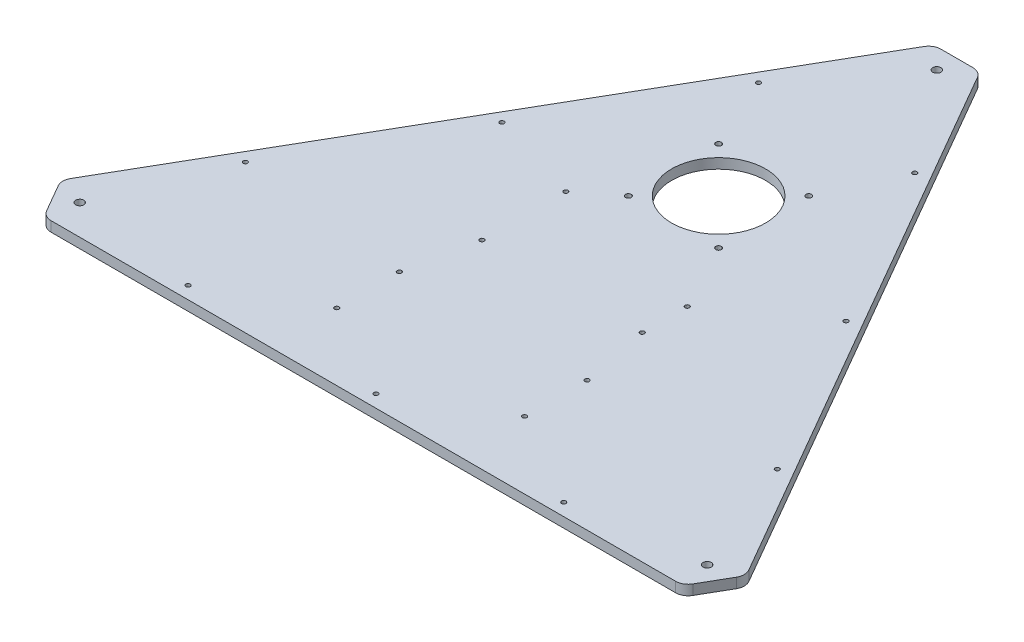
from build123d import *

# Parameters (mm, degrees)
SKETCH_1_R         = 3.25
SKETCH_1_R_2       = 37.5
SKETCH_1_R_3       = 2.25
SKETCH_1_R_4       = 1.75
EXTRUDE_1639_DEPTH = 4
FILLET_1_R         = 10
HOLE_WIZARD_3_5_D  = 3.5


with BuildPart() as part:
    # Эскиз1 → Extrude 1639 (new, symmetric)
    with BuildSketch(Plane(origin=(0, 0, 0), x_dir=(1, 0, 0), z_dir=(0, 1, 0))):
        Polygon((273.664027596, -136.63804004), (18.5, 305.31902002), (-18.5, 305.31902002), (-273.664027596, -136.63804004), (-255.164027596, -168.68097998), (255.164027596, -168.68097998), align=None)
        with Locations(Location((-250.557621135, -144.65951001, 0), (0, 0, 270))):
            Circle(SKETCH_1_R, mode=Mode.SUBTRACT)
        with Locations(Location((250.557621135, -144.65951001, 0), (0, 0, 270))):
            Circle(SKETCH_1_R, mode=Mode.SUBTRACT)
        with Locations(Location((0, 289.31902002, 0), (0, 0, 270))):
            Circle(SKETCH_1_R, mode=Mode.SUBTRACT)
        with Locations(Location((0, 115, 0), (0, 0, 270))):
            Circle(SKETCH_1_R_2, mode=Mode.SUBTRACT)
        with Locations(Location((36, 151, 0), (0, 0, 270))):
            Circle(SKETCH_1_R_3, mode=Mode.SUBTRACT)
        with Locations(Location((-36, 151, 0), (0, 0, 270))):
            Circle(SKETCH_1_R_3, mode=Mode.SUBTRACT)
        with Locations(Location((-36, 79, 0), (0, 0, 270))):
            Circle(SKETCH_1_R_3, mode=Mode.SUBTRACT)
        with Locations(Location((36, 79, 0), (0, 0, 270))):
            Circle(SKETCH_1_R_3, mode=Mode.SUBTRACT)
        with Locations(Location((-64, 57, 0), (0, 0, 270))):
            Circle(SKETCH_1_R_4, mode=Mode.SUBTRACT)
        with Locations(Location((-64, -10, 0), (0, 0, 270))):
            Circle(SKETCH_1_R_4, mode=Mode.SUBTRACT)
        with Locations(Location((64, -10, 0), (0, 0, 270))):
            Circle(SKETCH_1_R_4, mode=Mode.SUBTRACT)
        with Locations(Location((64, 26, 0), (0, 0, 270))):
            Circle(SKETCH_1_R_4, mode=Mode.SUBTRACT)
        with Locations(Location((75, -65, 0), (0, 0, 270))):
            Circle(SKETCH_1_R_4, mode=Mode.SUBTRACT)
        with Locations(Location((75, -115, 0), (0, 0, 270))):
            Circle(SKETCH_1_R_4, mode=Mode.SUBTRACT)
        with Locations(Location((-75, -115, 0), (0, 0, 270))):
            Circle(SKETCH_1_R_4, mode=Mode.SUBTRACT)
        with Locations(Location((-75, -65, 0), (0, 0, 270))):
            Circle(SKETCH_1_R_4, mode=Mode.SUBTRACT)
    extrude(amount=EXTRUDE_1639_DEPTH, both=True)

    # Скругление1
    fillet_1_edges = [part.edges().sort_by_distance(p)[0] for p in [
        (255.164027596, 0, 168.68097998),
        (-255.164027596, 0, 168.68097998),
        (-273.664027596, 0, 136.63804004),
        (-18.5, 0, -305.31902002),
        (18.5, 0, -305.31902002),
        (273.664027596, 0, 136.63804004),
    ]]
    fillet(fillet_1_edges, radius=FILLET_1_R)

    # К Профилю 3,5мм (through all)
    with Locations(Plane(origin=(0, 4, 0), x_dir=(1, 0, 0), z_dir=(0, 1, 0))):
        with Locations((-137.42175976, 79.34048999), (-62.42175976, 209.244300558), (62.42175976, 209.244300558), (137.42175976, 79.34048999), (212.42175976, -50.563320578), (150, -158.68097998), (0, -158.68097998), (-150, -158.68097998), (-212.42175976, -50.563320578)):
            Hole(HOLE_WIZARD_3_5_D / 2)


solid = part.part
